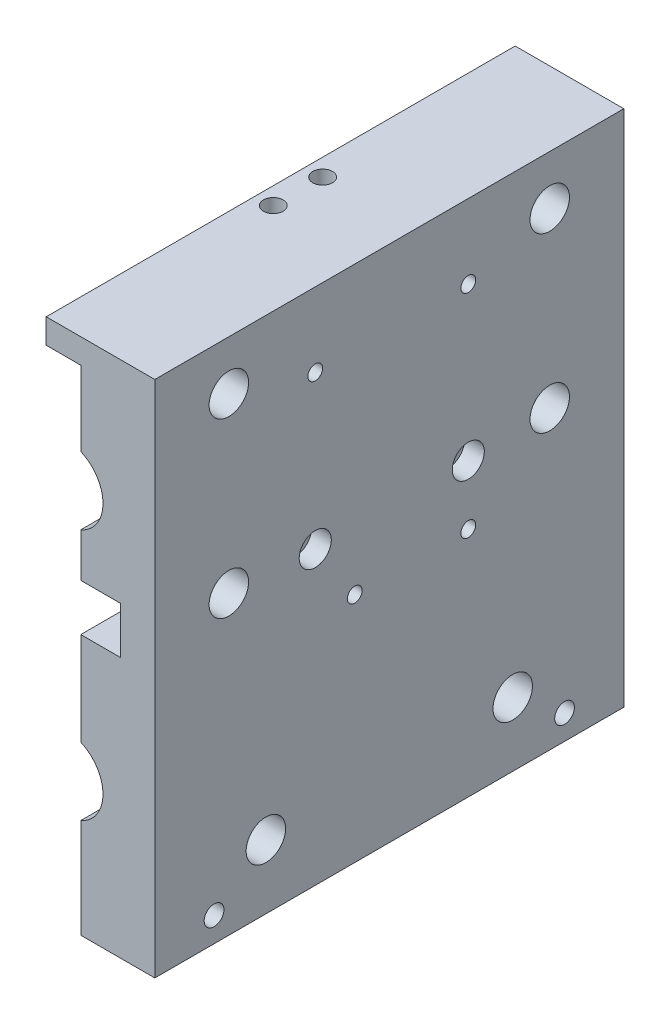
from build123d import *

# Parameters (mm, degrees)
BOSS_EXTRUDE1_DEPTH                = 95
SKETCH2_R                          = 2
CUT_EXTRUDE1_3DPRINTER4_DEPTH      = 139.744369255
ESQUISSE1_R                        = 1.5
ENL_V_MAT_EXTRU_1_3D_PRINTER_DEPTH = 140.67462189
ENL_V_MAT_EXTRU_2_DEPTH            = 139.744369255
ENL_V_MAT_EXTRU_2_DEPTH_BACK       = 3
ESQUISSE2_R                        = 2.5
ESQUISSE3_R                        = 3.25
ENL_V_MAT_EXTRU_3_DEPTH            = 4
ESQUISSE4_R                        = 2
ENL_V_MAT_EXTRU_4_DEPTH            = 140.67462189
ESQUISSE8_R                        = 7.5
ENL_V_MAT_EXTRU_9_DEPTH            = 139.744369255
ESQUISSE9_R                        = 4
ENL_V_MAT_EXTRU_10CNC_TROUS_DEPTH  = 140.67462189
ESQUISSE10_R                       = 2
ENL_V_MAT_EXTRU_10_DEPTH           = 139.744369255
ESQUISSE11_R                       = 2.5
ENL_V_MAT_EXTRU_11_DEPTH           = 5


with BuildPart() as part:
    # Sketch1 → Boss-Extrude1 (new body)
    with BuildSketch(Plane.XY):
        Polygon((0, 0), (0, -37.75), (8, -37.75), (8, -47.25), (0, -47.25), (0, -100), (15, -100), (15, 5), (-7, 5), (-7, 0), align=None)
    extrude(amount=BOSS_EXTRUDE1_DEPTH)

    # Sketch2 → Cut-Extrude1 3dprinter4 (cut, through all)
    with BuildSketch(Plane.ZY):
        with Locations(Location((62.5, -41, 0), (0, 0, 270))):
            Circle(SKETCH2_R)
        with Locations(Location((31.5, -41, 0), (0, 0, 270))):
            Circle(SKETCH2_R)
    extrude(amount=-CUT_EXTRUDE1_3DPRINTER4_DEPTH, mode=Mode.SUBTRACT)

    # Esquisse1 → Enlèv. mat.-Extru.1 3d printer (cut, through all)
    with BuildSketch(Plane(origin=(15, 0, 0), x_dir=(0, 0, -1), z_dir=(1, 0, 0))):
        with Locations(Location((-62.5, -10, 0), (0, 0, 90))):
            Circle(ESQUISSE1_R)
        with Locations(Location((-31.5, -10, 0), (0, 0, 90))):
            Circle(ESQUISSE1_R)
        with Locations(Location((-54.5, -53, 0), (0, 0, 90))):
            Circle(ESQUISSE1_R)
        with Locations(Location((-31.5, -53, 0), (0, 0, 90))):
            Circle(ESQUISSE1_R)
    extrude(amount=-ENL_V_MAT_EXTRU_1_3D_PRINTER_DEPTH, mode=Mode.SUBTRACT)

    # Esquisse2 → Enlèv. mat.-Extru.2 (cut, two sides: drawn at the far end of the back side and taken through both)
    with BuildSketch(Plane.ZY.offset(-ENL_V_MAT_EXTRU_2_DEPTH_BACK)):
        with Locations(Location((62.5, -10, 0), (0, 0, 90))):
            Circle(ESQUISSE2_R)
        with Locations(Location((31.5, -10, 0), (0, 0, 90))):
            Circle(ESQUISSE2_R)
    extrude(amount=ENL_V_MAT_EXTRU_2_DEPTH + ENL_V_MAT_EXTRU_2_DEPTH_BACK, mode=Mode.SUBTRACT)

    # Esquisse3 → Enlèv. mat.-Extru.3 (cut)
    with BuildSketch(Plane(origin=(15, 0, 0), x_dir=(0, 0, -1), z_dir=(1, 0, 0))):
        with Locations(Location((-31.5, -41, 0), (0, 0, 90))):
            Circle(ESQUISSE3_R)
        with Locations(Location((-62.5, -41, 0), (0, 0, 90))):
            Circle(ESQUISSE3_R)
    extrude(amount=-ENL_V_MAT_EXTRU_3_DEPTH, mode=Mode.SUBTRACT)

    # Esquisse4 → Enlèv. mat.-Extru.4 (cut, through all)
    with BuildSketch(Plane(origin=(15, 0, 0), x_dir=(0, 0, -1), z_dir=(1, 0, 0))):
        with Locations(Location((-83, -95, 0), (0, 0, 90))):
            Circle(ESQUISSE4_R)
        with Locations(Location((-12, -95, 0), (0, 0, 90))):
            Circle(ESQUISSE4_R)
    extrude(amount=-ENL_V_MAT_EXTRU_4_DEPTH, mode=Mode.SUBTRACT)

    # Esquisse8 → Enlèv. mat.-Extru.9 (cut, through all)
    with BuildSketch(Plane(origin=(0, 0, 0), x_dir=(-1, 0, 0), z_dir=(0, 0, -1))):
        with Locations((3, -22)):
            Circle(ESQUISSE8_R)
        with Locations((3, -73)):
            Circle(ESQUISSE8_R)
    extrude(amount=-ENL_V_MAT_EXTRU_9_DEPTH, mode=Mode.SUBTRACT)

    # Esquisse9 → Enlèv. mat.-Extru.10cnc trous (cut, through all)
    with BuildSketch(Plane(origin=(15, 0, 0), x_dir=(0, 0, -1), z_dir=(1, 0, 0))):
        with Locations(Location((-15, -5, 0), (0, 0, 90))):
            Circle(ESQUISSE9_R)
        with Locations(Location((-80, -5, 0), (0, 0, 90))):
            Circle(ESQUISSE9_R)
        with Locations(Location((-80, -40, 0), (0, 0, 90))):
            Circle(ESQUISSE9_R)
        with Locations(Location((-15, -40, 0), (0, 0, 90))):
            Circle(ESQUISSE9_R)
        with Locations(Location((-22.5, -87, 0), (0, 0, 90))):
            Circle(ESQUISSE9_R)
        with Locations(Location((-72.5, -87, 0), (0, 0, 90))):
            Circle(ESQUISSE9_R)
    extrude(amount=-ENL_V_MAT_EXTRU_10CNC_TROUS_DEPTH, mode=Mode.SUBTRACT)

    # Esquisse10 → Enlèv. mat.-Extru.10 (cut, through all)
    with BuildSketch(Plane.XZ):
        with Locations(Location((-3.5, 52.5, 0), (0, 0, 270))):
            Circle(ESQUISSE10_R)
        with Locations(Location((-3.5, 42.5, 0), (0, 0, 270))):
            Circle(ESQUISSE10_R)
    extrude(amount=-ENL_V_MAT_EXTRU_10_DEPTH, mode=Mode.SUBTRACT)

    # Esquisse11 → Enlèv. mat.-Extru.11 (cut)
    with BuildSketch(Plane.ZY):
        with Locations(Location((54.5, -53, 0), (0, 0, 270))):
            Circle(ESQUISSE11_R)
        with Locations(Location((31.5, -53, 0), (0, 0, 270))):
            Circle(ESQUISSE11_R)
    extrude(amount=-ENL_V_MAT_EXTRU_11_DEPTH, mode=Mode.SUBTRACT)


solid = part.part
